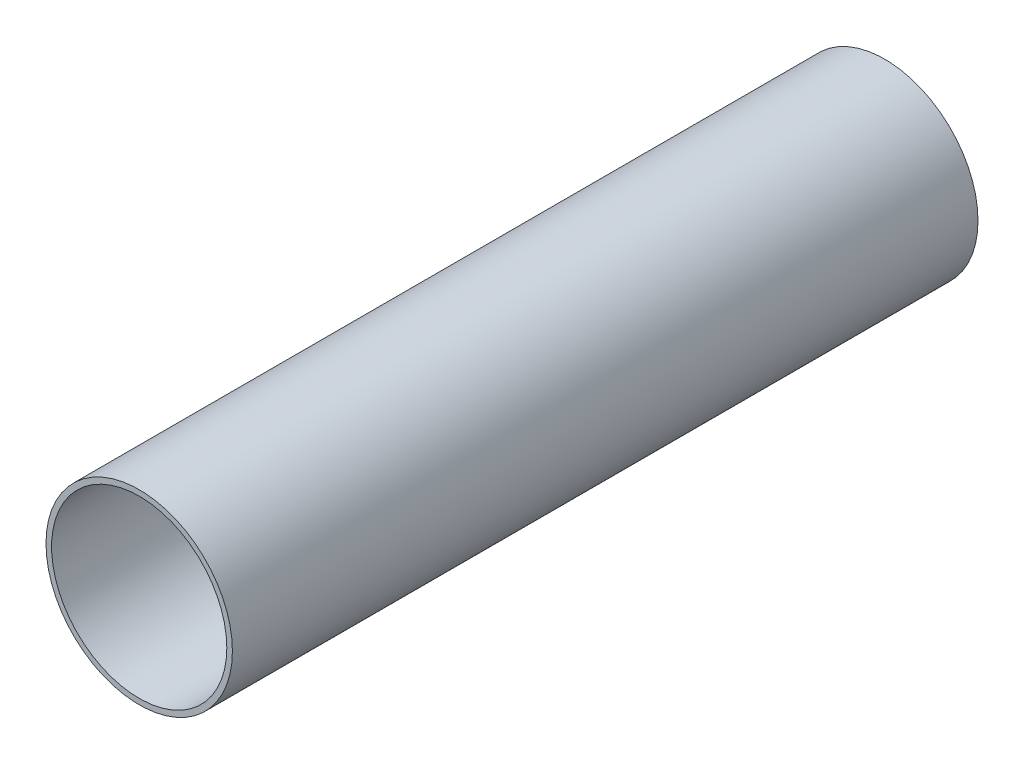
from build123d import *

# Parameters (mm, degrees)
SKETCH1_R           = 50
SKETCH1_R_2         = 47
BOSS_EXTRUDE1_DEPTH = 400


with BuildPart() as part:
    # Sketch1 → Boss-Extrude1 (new body)
    with BuildSketch(Plane.XY):
        Circle(SKETCH1_R)
        Circle(SKETCH1_R_2, mode=Mode.SUBTRACT)
    extrude(amount=BOSS_EXTRUDE1_DEPTH)


solid = part.part
